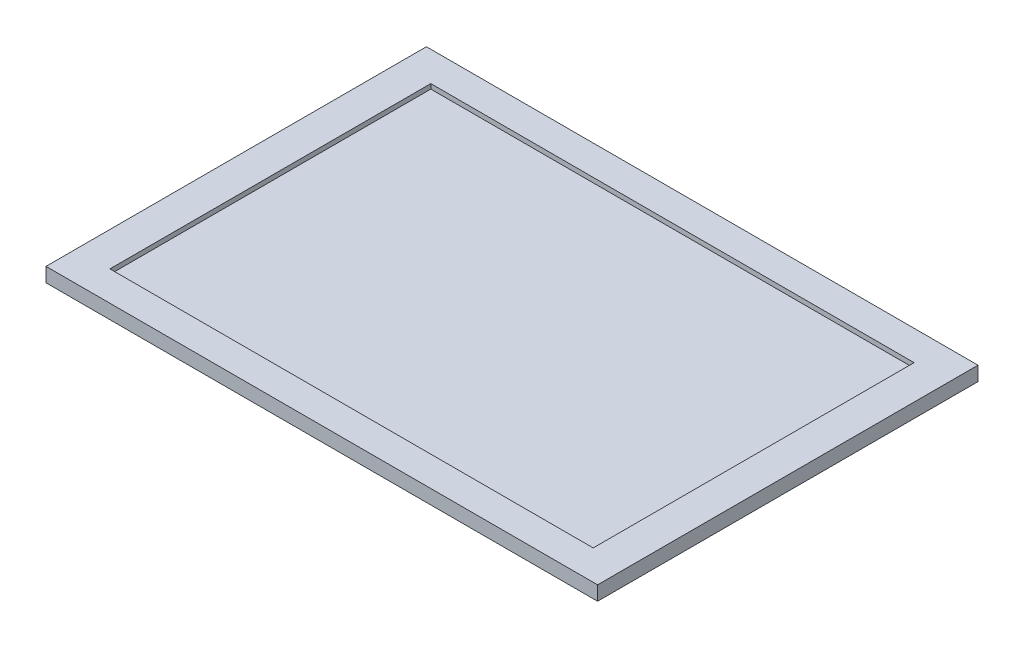
from build123d import *

# Parameters (mm, degrees)
SKETCH1_W           = 294.64
SKETCH1_H           = 203.2
BOSS_EXTRUDE1_DEPTH = 7.62
SKETCH2_W           = 258.15522189
SKETCH2_H           = 171.41031419
CUT_EXTRUDE1_DEPTH  = 2.54


with BuildPart() as part:
    # Sketch1 → Boss-Extrude1 (new body)
    with BuildSketch(Plane(origin=(0, 0, 0), x_dir=(1, 0, 0), z_dir=(0, 1, 0))):
        Rectangle(SKETCH1_W, SKETCH1_H)
    extrude(amount=BOSS_EXTRUDE1_DEPTH)

    # Sketch2 → Cut-Extrude1 (cut)
    with BuildSketch(Plane(origin=(0, 7.62, 0), x_dir=(1, 0, 0), z_dir=(0, 1, 0))):
        Rectangle(SKETCH2_W, SKETCH2_H)
    extrude(amount=-CUT_EXTRUDE1_DEPTH, mode=Mode.SUBTRACT)


solid = part.part
